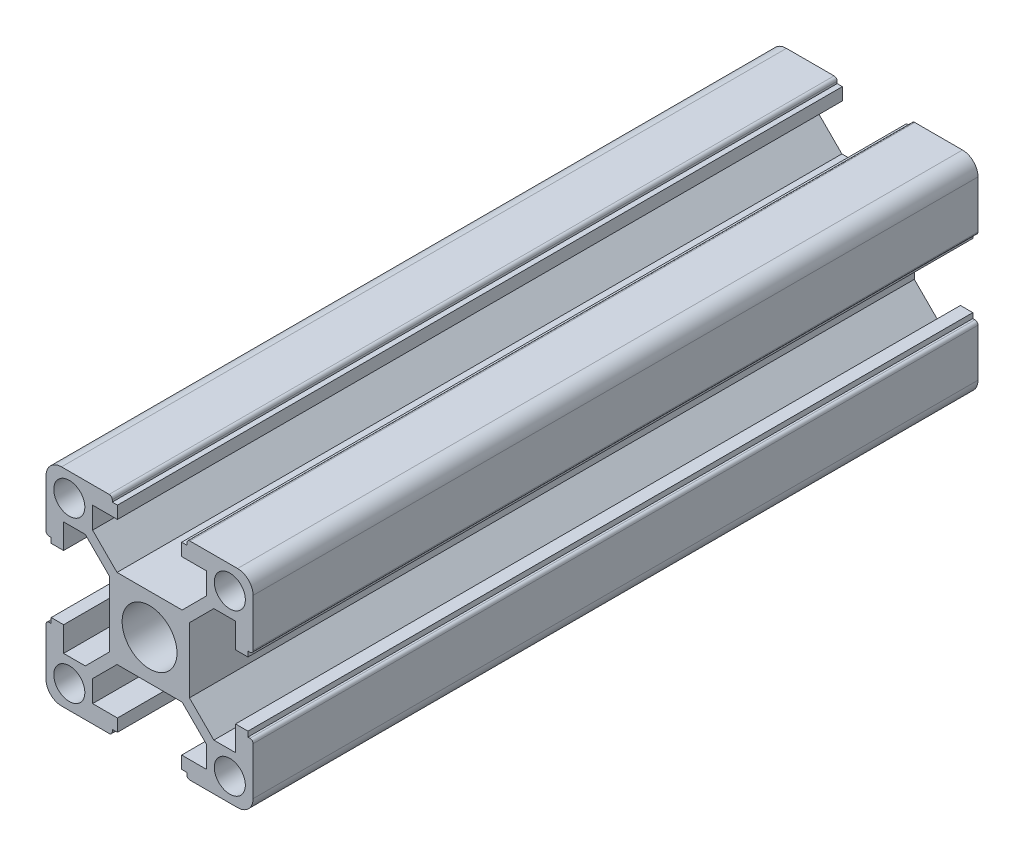
from build123d import *

# Parameters (mm, degrees)
SKETCH_1_R               = 2.65
SKETCH_1_R_2             = 1.5
EXTRUDE_1_DEPTH          = 35
CUT_EXTRUDE_1_DEPTH      = 38.749172176
CUT_EXTRUDE_1_DEPTH_BACK = 38.749172176
SKETCH_3_R               = 2
SKETCH_4_R               = 4.25
CUT_EXTRUDE_2_DEPTH      = 39.946405572
CUT_EXTRUDE_3_DEPTH      = 38.749172296
CUT_EXTRUDE_3_DEPTH_BACK = 38.749172296
SKETCH_5_R               = 2
SKETCH_6_R               = 4.25
CUT_EXTRUDE_4_DEPTH      = 39.946405598


with BuildPart() as part:
    # 草图1 → 凸台-拉伸1 (new, symmetric)
    with BuildSketch(Plane.XY):
        with BuildLine():
            Line((3.142893219, 3.85), (-3.142893219, 3.85))
            Line((-3.142893219, 3.85), (-5.5, 6.207106781))
            Line((-5.5, 6.207106781), (-5.5, 8.3))
            Line((-5.5, 8.3), (-3.1, 8.3))
            Line((-3.1, 8.3), (-3.1, 9.5))
            Line((-3.1, 9.5), (-3.6, 9.5))
            Line((-3.6, 9.5), (-3.6, 9.7))
            ThreePointArc((-3.6, 9.7), (-3.687867966, 9.912132034), (-3.9, 10))
            Line((-3.9, 10), (-8.5, 10))
            ThreePointArc((-8.5, 10), (-9.560660172, 9.560660172), (-10, 8.5))
            Line((-10, 8.5), (-10, 3.9))
            ThreePointArc((-10, 3.9), (-9.912132034, 3.687867966), (-9.7, 3.6))
            Line((-9.7, 3.6), (-9.5, 3.6))
            Line((-9.5, 3.6), (-9.5, 3.1))
            Line((-9.5, 3.1), (-8.3, 3.1))
            Line((-8.3, 3.1), (-8.3, 5.5))
            Line((-8.3, 5.5), (-6.207106781, 5.5))
            Line((-6.207106781, 5.5), (-3.85, 3.142893219))
            Line((-3.85, 3.142893219), (-3.85, -3.142893219))
            Line((-3.85, -3.142893219), (-6.207106781, -5.5))
            Line((-6.207106781, -5.5), (-8.3, -5.5))
            Line((-8.3, -5.5), (-8.3, -3.1))
            Line((-8.3, -3.1), (-9.5, -3.1))
            Line((-9.5, -3.1), (-9.5, -3.6))
            Line((-9.5, -3.6), (-9.7, -3.6))
            ThreePointArc((-9.7, -3.6), (-9.912132034, -3.687867966), (-10, -3.9))
            Line((-10, -3.9), (-10, -8.5))
            ThreePointArc((-10, -8.5), (-9.560660172, -9.560660172), (-8.5, -10))
            Line((-8.5, -10), (-3.9, -10))
            ThreePointArc((-3.9, -10), (-3.687867966, -9.912132034), (-3.6, -9.7))
            Line((-3.6, -9.7), (-3.6, -9.5))
            Line((-3.6, -9.5), (-3.1, -9.5))
            Line((-3.1, -9.5), (-3.1, -8.3))
            Line((-3.1, -8.3), (-5.5, -8.3))
            Line((-5.5, -8.3), (-5.5, -6.207106781))
            Line((-5.5, -6.207106781), (-3.142893219, -3.85))
            Line((-3.142893219, -3.85), (3.142893219, -3.85))
            Line((3.142893219, -3.85), (5.5, -6.207106781))
            Line((5.5, -6.207106781), (5.5, -8.3))
            Line((5.5, -8.3), (3.1, -8.3))
            Line((3.1, -8.3), (3.1, -9.5))
            Line((3.1, -9.5), (3.6, -9.5))
            Line((3.6, -9.5), (3.6, -9.7))
            ThreePointArc((3.6, -9.7), (3.687867966, -9.912132034), (3.9, -10))
            Line((3.9, -10), (8.5, -10))
            ThreePointArc((8.5, -10), (9.560660172, -9.560660172), (10, -8.5))
            Line((10, -8.5), (10, -3.9))
            ThreePointArc((10, -3.9), (9.912132034, -3.687867966), (9.7, -3.6))
            Line((9.7, -3.6), (9.5, -3.6))
            Line((9.5, -3.6), (9.5, -3.1))
            Line((9.5, -3.1), (8.3, -3.1))
            Line((8.3, -3.1), (8.3, -5.5))
            Line((8.3, -5.5), (6.207106781, -5.5))
            Line((6.207106781, -5.5), (3.85, -3.142893219))
            Line((3.85, -3.142893219), (3.85, 3.142893219))
            Line((3.85, 3.142893219), (6.207106781, 5.5))
            Line((6.207106781, 5.5), (8.3, 5.5))
            Line((8.3, 5.5), (8.3, 3.1))
            Line((8.3, 3.1), (9.5, 3.1))
            Line((9.5, 3.1), (9.5, 3.6))
            Line((9.5, 3.6), (9.7, 3.6))
            ThreePointArc((9.7, 3.6), (9.912132034, 3.687867966), (10, 3.9))
            Line((10, 3.9), (10, 8.5))
            ThreePointArc((10, 8.5), (9.560660172, 9.560660172), (8.5, 10))
            Line((8.5, 10), (3.9, 10))
            ThreePointArc((3.9, 10), (3.687867966, 9.912132034), (3.6, 9.7))
            Line((3.6, 9.7), (3.6, 9.5))
            Line((3.6, 9.5), (3.1, 9.5))
            Line((3.1, 9.5), (3.1, 8.3))
            Line((3.1, 8.3), (5.5, 8.3))
            Line((5.5, 8.3), (5.5, 6.207106781))
            Line((5.5, 6.207106781), (3.142893219, 3.85))
        make_face()
        Circle(SKETCH_1_R, mode=Mode.SUBTRACT)
        with Locations((-7.75, 7.75)):
            Circle(SKETCH_1_R_2, mode=Mode.SUBTRACT)
        with Locations((7.75, 7.75)):
            Circle(SKETCH_1_R_2, mode=Mode.SUBTRACT)
        with Locations((7.75, -7.75)):
            Circle(SKETCH_1_R_2, mode=Mode.SUBTRACT)
        with Locations((-7.75, -7.75)):
            Circle(SKETCH_1_R_2, mode=Mode.SUBTRACT)
    extrude(amount=EXTRUDE_1_DEPTH, both=True)

    # 草图3 → 切除-拉伸1 (cut, two sides: drawn at the far end of the back side and taken through both)
    with BuildSketch(Plane(origin=(0, 0, 0), x_dir=(1, 0, 0), z_dir=(0, 1, 0)).offset(-CUT_EXTRUDE_1_DEPTH_BACK)):
        with Locations(Location((0, -13, 0), (0, 0, 270))):
            Circle(SKETCH_3_R)
    extrude(amount=CUT_EXTRUDE_1_DEPTH + CUT_EXTRUDE_1_DEPTH_BACK, mode=Mode.SUBTRACT)

    # 草图4 → 切除-拉伸2 (cut, through all)
    with BuildSketch(Plane.XZ.offset(3.85)):
        with Locations((0, 13)):
            Circle(SKETCH_4_R)
    extrude(amount=CUT_EXTRUDE_2_DEPTH, mode=Mode.SUBTRACT)

    # 草图5 → 切除-拉伸3 (cut, two sides: drawn at the far end of the back side and taken through both)
    with BuildSketch(Plane(origin=(0, 0, 0), x_dir=(0, 0, -1), z_dir=(1, 0, 0)).offset(-CUT_EXTRUDE_3_DEPTH_BACK)):
        with Locations(Location((25, 0, 0), (0, 0, 180))):
            Circle(SKETCH_5_R)
    extrude(amount=CUT_EXTRUDE_3_DEPTH + CUT_EXTRUDE_3_DEPTH_BACK, mode=Mode.SUBTRACT)

    # 草图6 → 切除-拉伸4 (cut, through all)
    with BuildSketch(Plane.ZY.offset(3.85)):
        with Locations((-25, 0)):
            Circle(SKETCH_6_R)
    extrude(amount=CUT_EXTRUDE_4_DEPTH, mode=Mode.SUBTRACT)


solid = part.part
